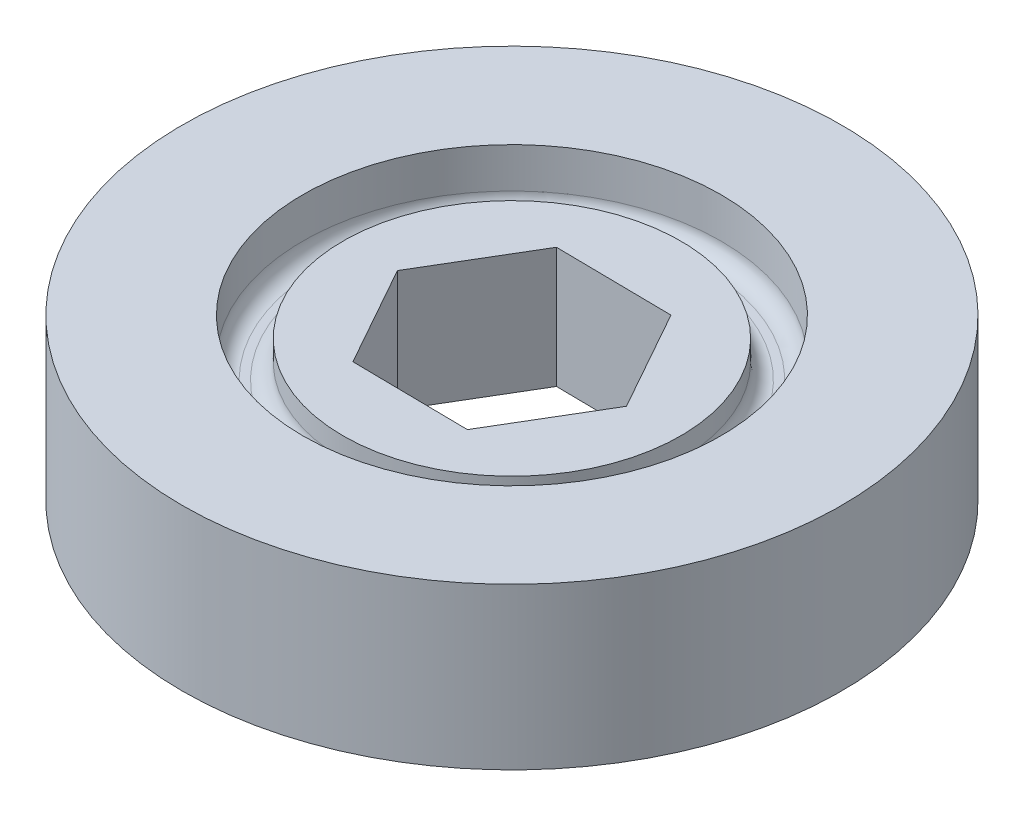
from build123d import *

# Parameters (mm, degrees)
SKETCH1_R               = 20.5
BOSS_EXTRUDE1_DEPTH     = 10
SKETCH2_R               = 13
CUT_EXTRUDE1_DEPTH      = 3.5
CUT_EXTRUDE2_START      = -3.5
SKETCH3_R               = 13
CUT_EXTRUDE2_DEPTH      = 3.5
SKETCH5_R               = 10.5
BOSS_EXTRUDE2_DEPTH     = 2.25
BOSS_EXTRUDE3_START     = 2.25
SKETCH6_R               = 10.5
BOSS_EXTRUDE3_DEPTH     = 2.25
CUT_EXTRUDE3_DEPTH      = 30.711109033
CUT_EXTRUDE3_DEPTH_BACK = 30.711109033
FILLET1_R               = 1
FILLET2_R               = 1


with BuildPart() as part:
    # Sketch1 → Boss-Extrude1 (new body)
    with BuildSketch(Plane(origin=(0, 0, 0), x_dir=(1, 0, 0), z_dir=(0, 1, 0))):
        with Locations(Location((0, 0, 0), (0, 0, 270))):
            Circle(SKETCH1_R)
    extrude(amount=BOSS_EXTRUDE1_DEPTH)

    # Sketch2 → Cut-Extrude1 (cut)
    with BuildSketch(Plane(origin=(0, 10, 0), x_dir=(1, 0, 0), z_dir=(0, 1, 0))):
        with Locations(Location((0, 0, 0), (0, 0, 270))):
            Circle(SKETCH2_R)
    extrude(amount=-CUT_EXTRUDE1_DEPTH, mode=Mode.SUBTRACT)

    # Sketch3 → Cut-Extrude2 (cut)
    with BuildSketch(Plane.XZ.offset(CUT_EXTRUDE2_START)):
        with Locations(Location((0, 0, 0), (0, 0, 90))):
            Circle(SKETCH3_R)
    extrude(amount=CUT_EXTRUDE2_DEPTH, mode=Mode.SUBTRACT)

    # Sketch5 → Boss-Extrude2 (add)
    with BuildSketch(Plane(origin=(0, 6.5, 0), x_dir=(1, 0, 0), z_dir=(0, 1, 0))):
        with Locations(Location((0, 0, 0), (0, 0, 270))):
            Circle(SKETCH5_R)
    extrude(amount=BOSS_EXTRUDE2_DEPTH)

    # Sketch6 → Boss-Extrude3 (add)
    with BuildSketch(Plane.XZ.offset(-3.5).offset(BOSS_EXTRUDE3_START)):
        with Locations(Location((0, 0, 0), (0, 0, 90))):
            Circle(SKETCH6_R)
    extrude(amount=-BOSS_EXTRUDE3_DEPTH)

    # Sketch4 → Cut-Extrude3 (cut, two sides: drawn at the far end of the back side and taken through both)
    with BuildSketch(Plane(origin=(0, 6.5, 0), x_dir=(1, 0, 0), z_dir=(0, 1, 0)).offset(-CUT_EXTRUDE3_DEPTH_BACK)):
        Polygon((3.689639098, 6.202410552), (-3.526625554, 6.296526466), (-7.216264652, 0.094115913), (-3.689639098, -6.202410552), (3.526625554, -6.296526466), (7.216264652, -0.094115913), align=None)
    extrude(amount=CUT_EXTRUDE3_DEPTH + CUT_EXTRUDE3_DEPTH_BACK, mode=Mode.SUBTRACT)

    # Fillet1
    fillet1_edges = [part.edges().sort_by_distance(p)[0] for p in [
        (0, 3.5, -13),
        (0, 6.5, -13),
    ]]
    fillet(fillet1_edges, radius=FILLET1_R)

    # Fillet2
    fillet2_edges = [part.edges().sort_by_distance(p)[0] for p in [
        (0, 6.5, -10.5),
        (0, 3.5, -10.5),
    ]]
    fillet(fillet2_edges, radius=FILLET2_R)


solid = part.part
